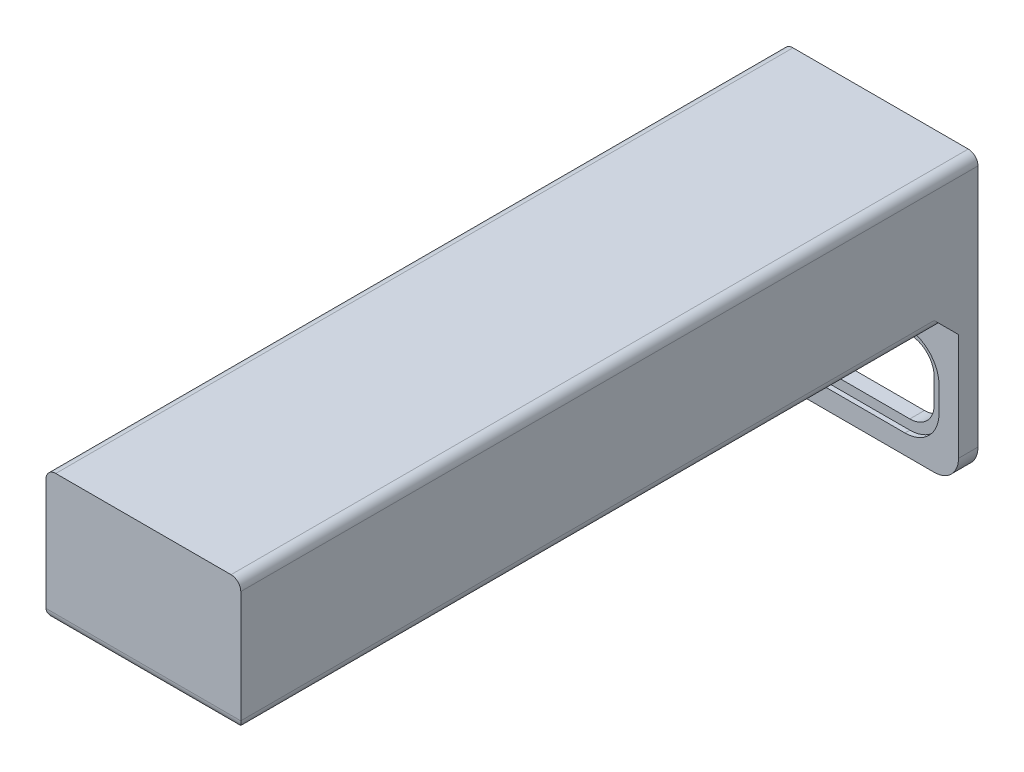
from build123d import *

# Parameters (mm, degrees)
ESQUISSE1_W             = 200
ESQUISSE1_H             = 135
BOSS_EXTRU_1_DEPTH      = 727
COQUE1_T                = -10
ESQUISSE2_W             = 20
ESQUISSE2_H             = 500
ENL_V_MAT_EXTRU_1_DEPTH = 10
ESQUISSE3_W             = 200
ESQUISSE3_H             = 150
BOSS_EXTRU_2_DEPTH      = 20
CHANFREIN1_SIZE         = 15
ESQUISSE4_W             = 140
ESQUISSE4_H             = 75
ENL_V_MAT_EXTRU_2_DEPTH = 747.428328776
CONG_3_R                = 25
CONG_2_R                = 25
ENL_V_START             = -5
ENL_V_MAT_EXTRU_3_DEPTH = 5
ESQUISSE8_W             = 200
ESQUISSE8_H             = 135
BOSS_EXTRU_3_DEPTH      = 30
CONG_5_R                = 10


with BuildPart() as part:
    # Esquisse1 → Boss.-Extru.1 (new body)
    with BuildSketch(Plane.XY):
        Rectangle(ESQUISSE1_W, ESQUISSE1_H)
    extrude(amount=BOSS_EXTRU_1_DEPTH)

    # Coque1
    coque1_openings = [part.faces().sort_by_distance(p)[0] for p in [
        (0, 0, 0),
    ]]
    offset(amount=COQUE1_T, openings=coque1_openings, kind=Kind.INTERSECTION)

    # Esquisse2 → Enlèv. mat.-Extru.1 (cut)
    with BuildSketch(Plane.XZ.offset(67.5)):
        with Locations((-60, 457)):
            Rectangle(ESQUISSE2_W, ESQUISSE2_H)
        with Locations((60, 457)):
            Rectangle(ESQUISSE2_W, ESQUISSE2_H)
    extrude(amount=-ENL_V_MAT_EXTRU_1_DEPTH, mode=Mode.SUBTRACT)

    # Esquisse3 → Boss.-Extru.2 (add)
    with BuildSketch(Plane(origin=(0, 0, 0), x_dir=(-1, 0, 0), z_dir=(0, 0, -1))):
        with Locations((0, -142.5)):
            Rectangle(ESQUISSE3_W, ESQUISSE3_H)
    extrude(amount=-BOSS_EXTRU_2_DEPTH)

    # Chanfrein1
    chanfrein1_edges = [part.edges().sort_by_distance(p)[0] for p in [
        (0, -67.5, 20),
    ]]
    chamfer(chanfrein1_edges, length=CHANFREIN1_SIZE)

    # Esquisse4 → Enlèv. mat.-Extru.2 (cut, through all)
    with BuildSketch(Plane.XY.offset(20)):
        with Locations((0, -150)):
            Rectangle(ESQUISSE4_W, ESQUISSE4_H)
    extrude(amount=-ENL_V_MAT_EXTRU_2_DEPTH, mode=Mode.SUBTRACT)

    # Congé3
    cong_3_edges = [part.edges().sort_by_distance(p)[0] for p in [
        (70, -187.5, 10),
        (-70, -187.5, 10),
        (-70, -112.5, 10),
        (70, -112.5, 10),
    ]]
    fillet(cong_3_edges, radius=CONG_3_R)

    # Congé2
    cong_2_edges = [part.edges().sort_by_distance(p)[0] for p in [
        (-100, -217.5, 10),
        (100, -217.5, 10),
    ]]
    fillet(cong_2_edges, radius=CONG_2_R)

    # Esquisse5 → Enlèv. mat.-Extru.3 (cut)
    with BuildSketch(Plane.XY.offset(20).offset(ENL_V_START)):
        with BuildLine():
            Line((45, -102.5), (-45, -102.5))
            ThreePointArc((-45, -102.5), (-69.748737342, -112.751262658), (-80, -137.5))
            Line((-80, -137.5), (-80, -162.5))
            ThreePointArc((-80, -162.5), (-69.748737342, -187.248737342), (-45, -197.5))
            Line((-45, -197.5), (45, -197.5))
            ThreePointArc((45, -197.5), (69.748737342, -187.248737342), (80, -162.5))
            Line((80, -162.5), (80, -137.5))
            ThreePointArc((80, -137.5), (69.748737342, -112.751262658), (45, -102.5))
        make_face()
        with BuildLine():
            Line((70, -162.5), (70, -137.5))
            ThreePointArc((70, -137.5), (62.67766953, -119.82233047), (45, -112.5))
            Line((45, -112.5), (-45, -112.5))
            ThreePointArc((-45, -112.5), (-62.67766953, -119.82233047), (-70, -137.5))
            Line((-70, -137.5), (-70, -162.5))
            ThreePointArc((-70, -162.5), (-62.67766953, -180.17766953), (-45, -187.5))
            Line((-45, -187.5), (45, -187.5))
            ThreePointArc((45, -187.5), (62.67766953, -180.17766953), (70, -162.5))
        make_face(mode=Mode.SUBTRACT)
    extrude(amount=ENL_V_MAT_EXTRU_3_DEPTH, mode=Mode.SUBTRACT)

    # Esquisse8 → Boss.-Extru.3 (add)
    with BuildSketch(Plane.XY.offset(727)):
        Rectangle(ESQUISSE8_W, ESQUISSE8_H)
    extrude(amount=BOSS_EXTRU_3_DEPTH)

    # Congé5
    cong_5_edges = [part.edges().sort_by_distance(p)[0] for p in [
        (0, -67.5, 757),
        (100, -67.5, 396),
        (-100, -67.5, 396),
        (-100, 67.5, 378.5),
        (100, 67.5, 378.5),
    ]]
    fillet(cong_5_edges, radius=CONG_5_R)


solid = part.part
